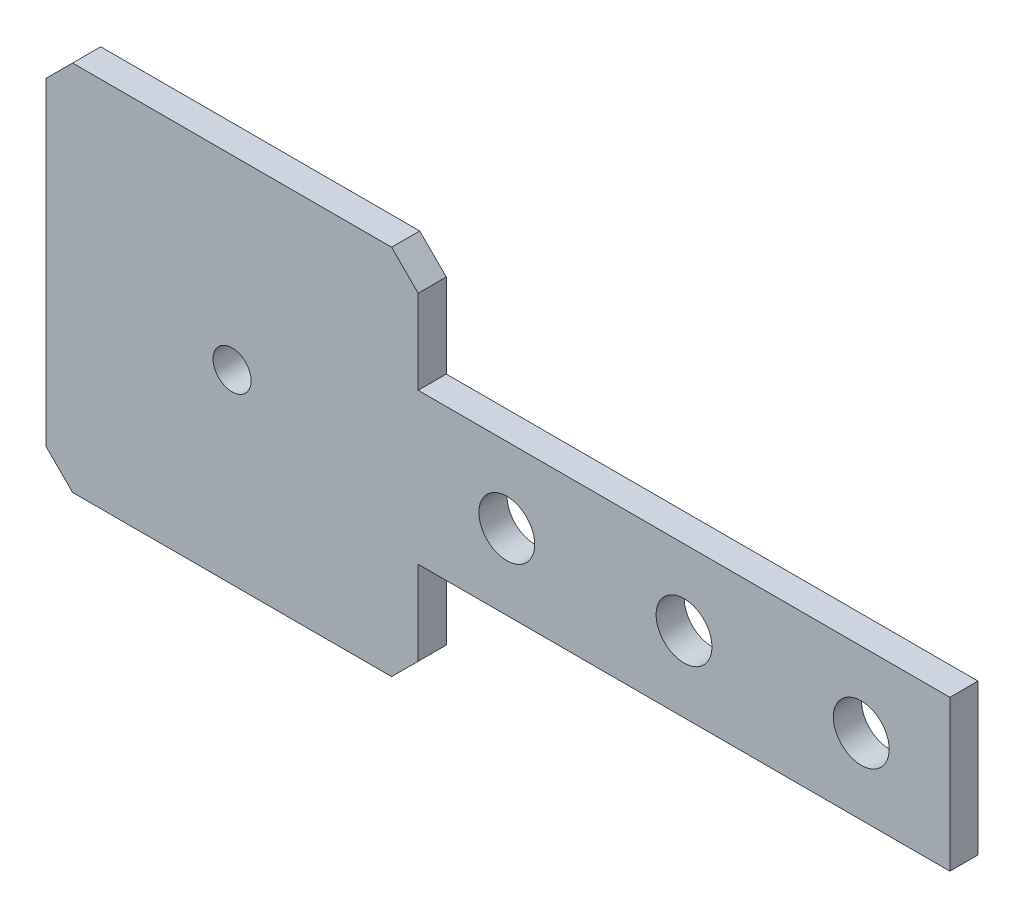
from build123d import *

# Parameters (mm, degrees)
SKETCH1_R           = 2.15
SKETCH1_R_2         = 3.15
BOSS_EXTRUDE1_DEPTH = 3.175


with BuildPart() as part:
    # Sketch1 → Boss-Extrude1 (new body)
    with BuildSketch(Plane.XY):
        Polygon((-90.069533508, -51.077079226), (-90.069533508, -41.592555764), (-30.069533508, -41.592555764), (-30.069533508, -24.592555764), (-90.069533508, -24.592555764), (-90.069533508, -15.108032302), (-93.069533508, -12.108032302), (-129.069533508, -12.108032302), (-132.069533508, -15.108032302), (-132.069533508, -51.077079226), (-129.069533508, -54.077079226), (-93.069533508, -54.077079226), align=None)
        with Locations((-111.069533508, -33.092555764)):
            Circle(SKETCH1_R, mode=Mode.SUBTRACT)
        with Locations((-40.069533508, -33.092555764)):
            Circle(SKETCH1_R_2, mode=Mode.SUBTRACT)
        with Locations((-60.069533508, -33.092555764)):
            Circle(SKETCH1_R_2, mode=Mode.SUBTRACT)
        with Locations((-80.069533508, -33.092555764)):
            Circle(SKETCH1_R_2, mode=Mode.SUBTRACT)
    extrude(amount=BOSS_EXTRUDE1_DEPTH)


solid = part.part
